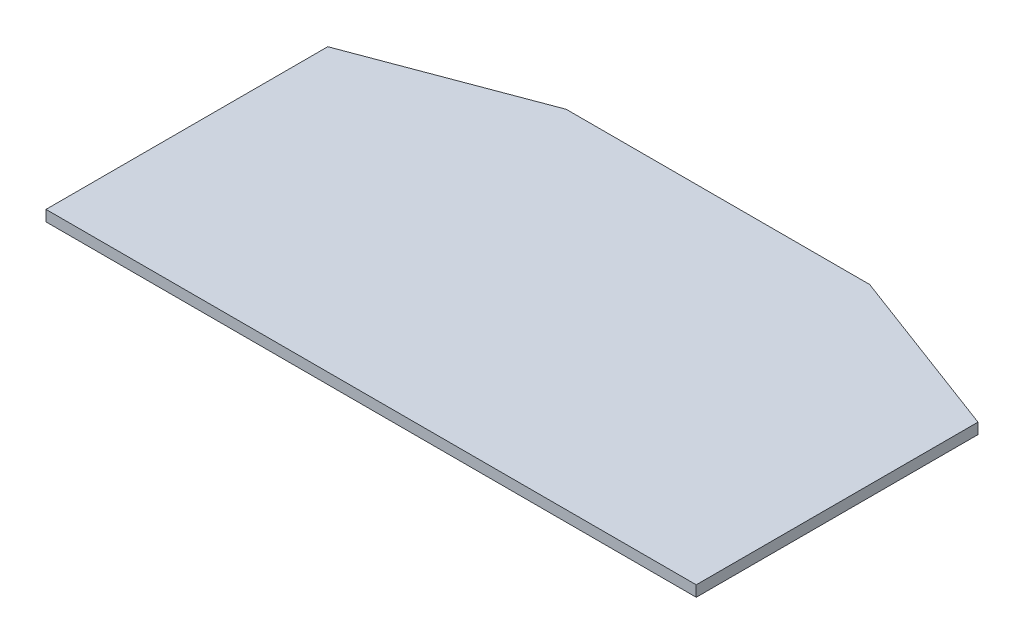
from build123d import *

# Parameters (mm, degrees)
BOSS_EXTRUDE1_DEPTH = 12.7


with BuildPart() as part:
    # Sketch1 → Boss-Extrude1 (new body)
    with BuildSketch(Plane(origin=(0, 0, 0), x_dir=(1, 0, 0), z_dir=(0, 1, 0))):
        Polygon((-92.921646993, 89.018434179), (669.078353007, 89.018434179), (669.078353007, 419.218434179), (465.878353007, 495.418434179), (110.278353007, 495.418434179), (-92.921646993, 419.218434179), align=None)
    extrude(amount=BOSS_EXTRUDE1_DEPTH)


solid = part.part
